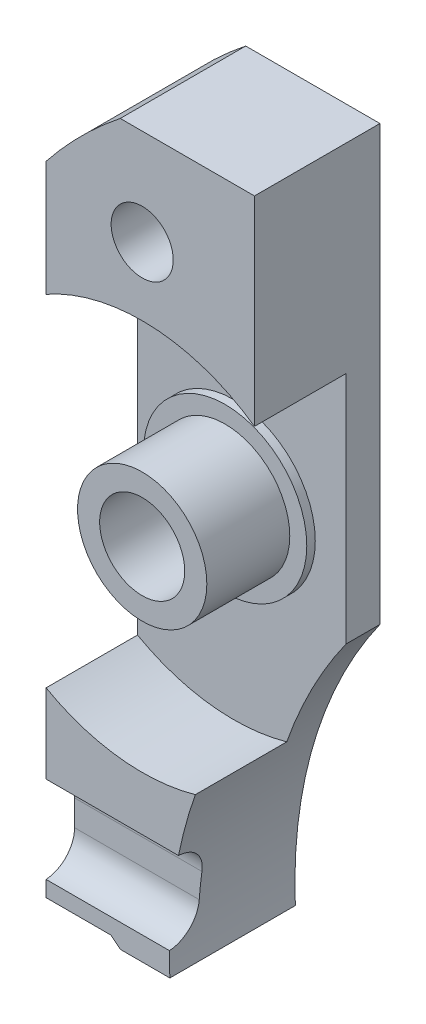
from build123d import *

# Parameters (mm, degrees)
SKETCH1_W           = 12.25
SKETCH1_H           = 42.3
BOSS_EXTRUDE1_DEPTH = 7.375
SKETCH2_R           = 1.825
SKETCH2_R_2         = 2.5
CUT_EXTRUDE1_DEPTH  = 24.22129949
CUT_EXTRUDE2_DEPTH  = 24.22129949
SKETCH4_R           = 11.5
CUT_EXTRUDE3_DEPTH  = 5.375
BOSS_EXTRUDE2_START = 0.5
SKETCH5_R           = 4.8
SKETCH5_R_2         = 2.5
BOSS_EXTRUDE2_DEPTH = 0.5
BOSS_EXTRUDE3_START = 4.875
SKETCH6_R           = 3.8
SKETCH6_R_2         = 2.5
BOSS_EXTRUDE3_DEPTH = 4.875
BOSS_EXTRUDE4_REACH = 27.53
CUT_EXTRUDE4_DEPTH  = 26.529896802


with BuildPart() as part:
    # Sketch1 → Boss-Extrude1 (new body)
    with BuildSketch(Plane.XY):
        Rectangle(SKETCH1_W, SKETCH1_H)
    extrude(amount=BOSS_EXTRUDE1_DEPTH)

    # Sketch2 → Cut-Extrude1 (cut, through all)
    with BuildSketch(Plane.XY.offset(7.375)):
        with Locations((-0.475, 15.5)):
            Circle(SKETCH2_R)
        with Locations((-0.475, 0)):
            Circle(SKETCH2_R_2)
    extrude(amount=-CUT_EXTRUDE1_DEPTH, mode=Mode.SUBTRACT)

    # Sketch3 → Cut-Extrude2 (cut, through all)
    with BuildSketch(Plane.XY.offset(7.375)):
        with BuildLine():
            Line((-6.125, -21.15), (-6.125, -16.783974467))
            ThreePointArc((-6.125, -16.783974467), (-4.066466825, -19.092268783), (-1.757457575, -21.15))
            Line((-1.757457575, -21.15), (-6.125, -21.15))
        make_face()
        with BuildLine():
            Line((-6.125, 16.789834467), (-6.125, 21.15))
            Line((-6.125, 21.15), (-1.764842259, 21.15))
            ThreePointArc((-1.764842259, 21.15), (-4.069800152, 19.094796032), (-6.125, 16.789834467))
        make_face()
        with BuildLine():
            Line((6.125, -4.351807973), (6.125, -21.15))
            Line((6.125, -21.15), (1.151863079, -21.15))
            ThreePointArc((1.151863079, -21.15), (2.238128282, -12.336341525), (6.125, -4.351807973))
        make_face()
    extrude(amount=-CUT_EXTRUDE2_DEPTH, mode=Mode.SUBTRACT)

    # Sketch4 → Cut-Extrude3 (cut)
    with BuildSketch(Plane.XY.offset(7.375)):
        with Locations((-0.475, 0)):
            Circle(SKETCH4_R)
    extrude(amount=-CUT_EXTRUDE3_DEPTH, mode=Mode.SUBTRACT)

    # Sketch5 → Boss-Extrude2 (add)
    with BuildSketch(Plane.XY.offset(2).offset(BOSS_EXTRUDE2_START)):
        with Locations((-0.475, 0)):
            Circle(SKETCH5_R)
        with Locations((-0.475, 0)):
            Circle(SKETCH5_R_2, mode=Mode.SUBTRACT)
    extrude(amount=-BOSS_EXTRUDE2_DEPTH)

    # Sketch6 → Boss-Extrude3 (add)
    with BuildSketch(Plane.XY.offset(2.5).offset(BOSS_EXTRUDE3_START)):
        with Locations((-0.475, 0)):
            Circle(SKETCH6_R)
        with Locations((-0.475, 0)):
            Circle(SKETCH6_R_2, mode=Mode.SUBTRACT)
    extrude(amount=-BOSS_EXTRUDE3_DEPTH)

    # Sketch7 → Boss-Extrude4 (add, up to next)
    with BuildSketch(Plane(origin=(-6.125, 0, 0), x_dir=(0, 0, -1), z_dir=(1, 0, 0)), mode=Mode.PRIVATE) as boss_extrude4_sk1:
        with BuildLine():
            Line((-7.375, -13.721160181), (-7.375, -20.698803049))
            ThreePointArc((-7.375, -20.698803049), (-2.25, -17.209981615), (-7.375, -13.721160181))
        make_face()
    boss_extrude4_tool1 = extrude(boss_extrude4_sk1.sketch, amount=BOSS_EXTRUDE4_REACH, mode=Mode.PRIVATE) - part.part
    add(boss_extrude4_tool1.solids().sort_by_distance((-6.125, -17.209982, 5.119864))[0])

    # Sketch8 → Cut-Extrude4 (cut, through all)
    with BuildSketch(Plane(origin=(-6.125, 0, 0), x_dir=(0, 0, -1), z_dir=(1, 0, 0))):
        with BuildLine():
            Line((-9.3, -17.973571615), (-9.3, -16.459481615))
            ThreePointArc((-9.3, -16.459481615), (-7.5, -14.659481615), (-5.7, -16.459481615))
            Line((-5.7, -16.459481615), (-5.7, -17.973571615))
            ThreePointArc((-5.7, -17.973571615), (-7.5, -19.773571615), (-9.3, -17.973571615))
        make_face()
    extrude(amount=CUT_EXTRUDE4_DEPTH, mode=Mode.SUBTRACT)


solid = part.part
